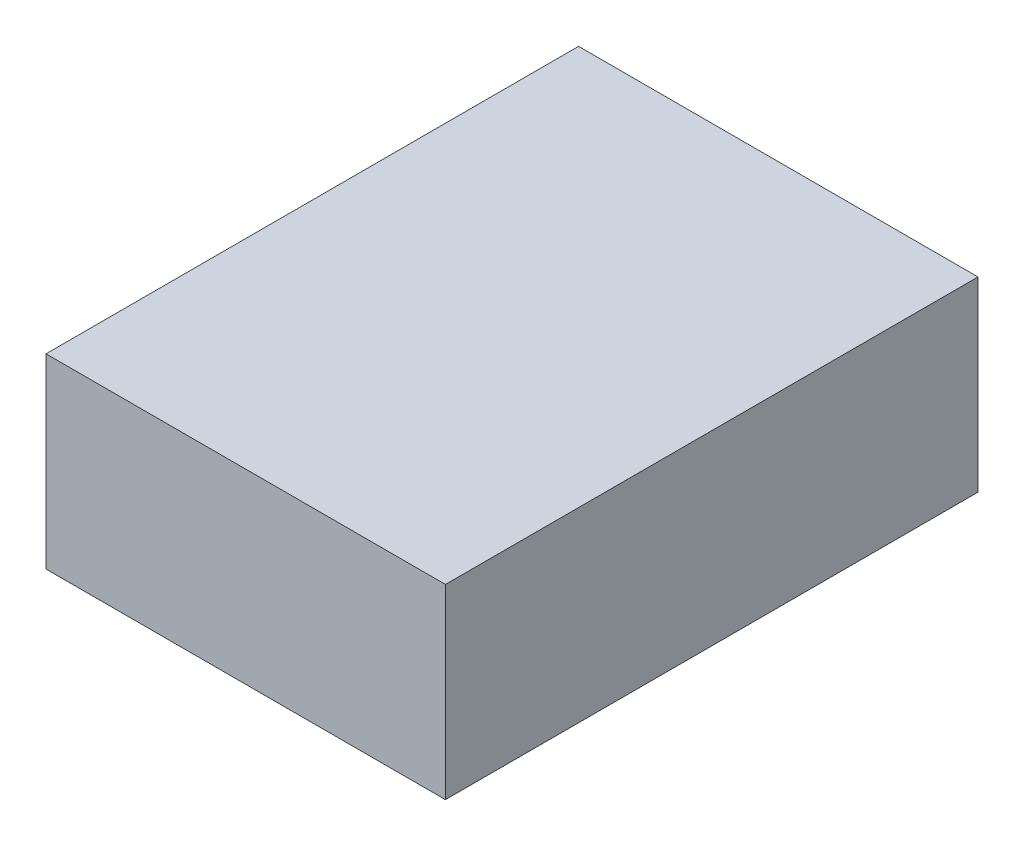
from build123d import *

# Parameters (mm, degrees)
SKETCH1_W           = 150
SKETCH1_H           = 200
BOSS_EXTRUDE1_DEPTH = 70


with BuildPart() as part:
    # Sketch1 → Boss-Extrude1 (new body)
    with BuildSketch(Plane(origin=(0, 0, 0), x_dir=(1, 0, 0), z_dir=(0, 1, 0))):
        Rectangle(SKETCH1_W, SKETCH1_H)
    extrude(amount=BOSS_EXTRUDE1_DEPTH)


solid = part.part
